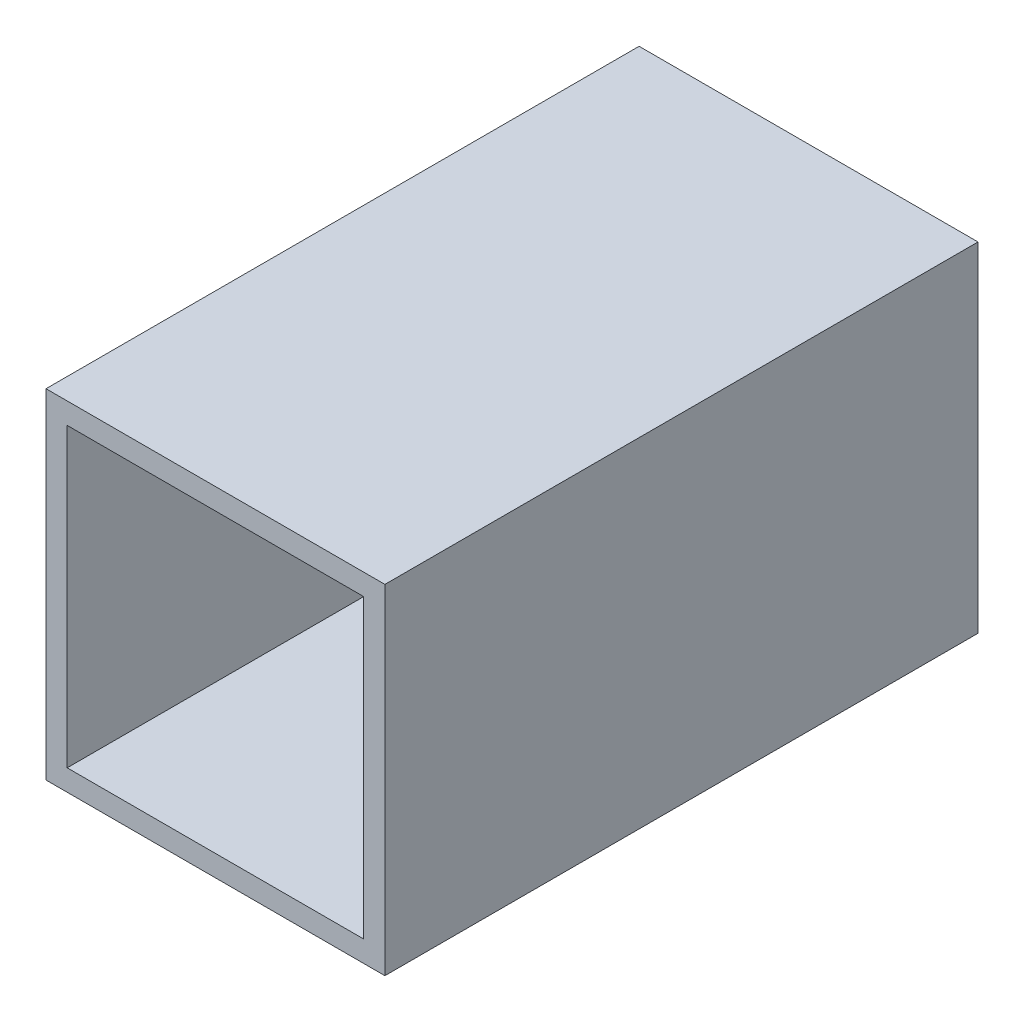
from build123d import *

# Parameters (mm, degrees)
SKETCH1_W           = 25.4
SKETCH1_H           = 25.4
SKETCH1_W_2         = 22.225
SKETCH1_H_2         = 22.225
BOSS_EXTRUDE1_DEPTH = 44.45


with BuildPart() as part:
    # Sketch1 → Boss-Extrude1 (new body)
    with BuildSketch(Plane.XY):
        Rectangle(SKETCH1_W, SKETCH1_H)
        Rectangle(SKETCH1_W_2, SKETCH1_H_2, mode=Mode.SUBTRACT)
    extrude(amount=BOSS_EXTRUDE1_DEPTH)


solid = part.part
